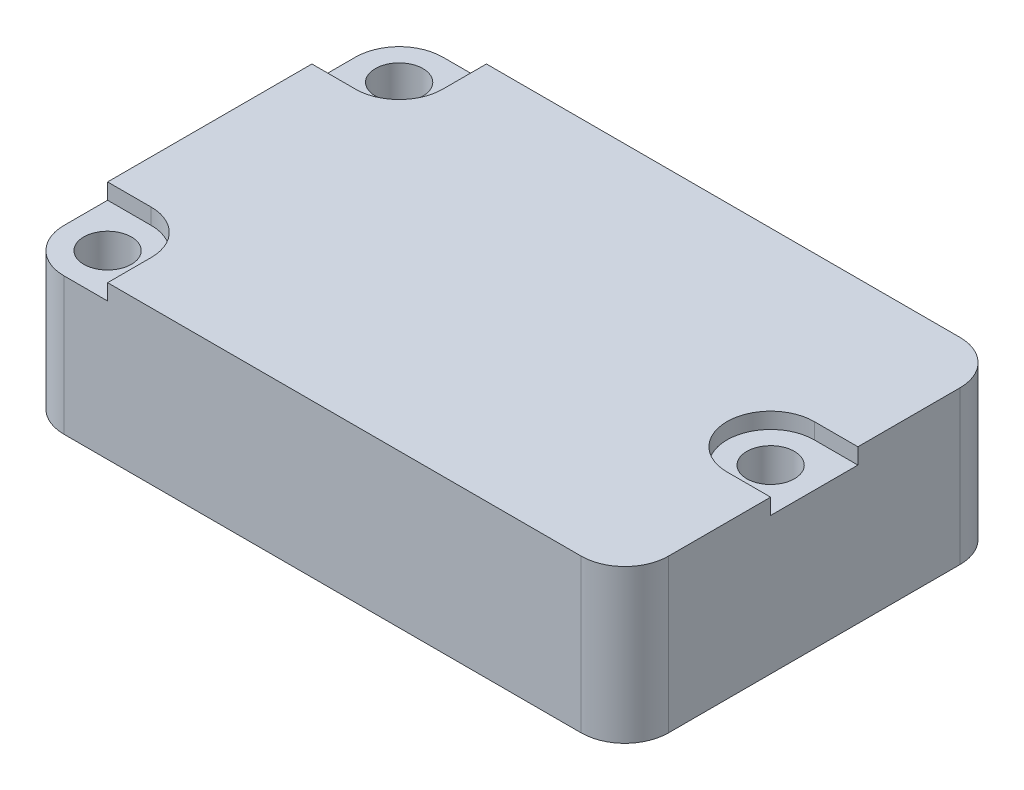
from build123d import *

# Parameters (mm, degrees)
SKETCH1_R           = 1.5
BOSS_EXTRUDE1_DEPTH = 9.65
CUT_EXTRUDE1_START  = -1
SKETCH2_R           = 1.5
CUT_EXTRUDE1_DEPTH  = 1
SKETCH4_W           = 12.876
SKETCH4_H           = 8
CUT_EXTRUDE2_DEPTH  = 3


with BuildPart() as part:
    # Sketch1 → Boss-Extrude1 (new body)
    with BuildSketch(Plane(origin=(0, 0, 0), x_dir=(1, 0, 0), z_dir=(0, 1, 0))):
        with BuildLine():
            Line((2.75, 0), (35.35, 0))
            ThreePointArc((35.35, 0), (37.294543648, -0.805456352), (38.1, -2.75))
            Line((38.1, -2.75), (38.1, -21.126))
            ThreePointArc((38.1, -21.126), (37.294543648, -23.070543648), (35.35, -23.876))
            Line((35.35, -23.876), (2.75, -23.876))
            ThreePointArc((2.75, -23.876), (0.805456352, -23.070543648), (0, -21.126))
            Line((0, -21.126), (0, -2.75))
            ThreePointArc((0, -2.75), (0.805456352, -0.805456352), (2.75, 0))
        make_face()
        with Locations(Location((2.75, -2.75, 0), (0, 0, 270))):
            Circle(SKETCH1_R, mode=Mode.SUBTRACT)
        with Locations(Location((2.75, -21.126, 0), (0, 0, 270))):
            Circle(SKETCH1_R, mode=Mode.SUBTRACT)
        with Locations(Location((35.35, -11.938, 0), (0, 0, 270))):
            Circle(SKETCH1_R, mode=Mode.SUBTRACT)
    extrude(amount=BOSS_EXTRUDE1_DEPTH)

    # Sketch2 → Cut-Extrude1 (cut)
    # profile 1 of 20: a face of its own
    with BuildSketch(Plane(origin=(0, 9.65, 0), x_dir=(1, 0, 0), z_dir=(0, 1, 0)).offset(CUT_EXTRUDE1_START)):
        with BuildLine():
            Line((2.75, -18.376), (0, -18.376))
            Line((0, -18.376), (0, -21.126))
            ThreePointArc((0, -21.126), (0.805456352, -19.181456352), (2.75, -18.376))
        make_face()
    # profile 2 of 20: a face of its own
    with BuildSketch(Plane(origin=(0, 9.65, 0), x_dir=(1, 0, 0), z_dir=(0, 1, 0)).offset(CUT_EXTRUDE1_START)):
        with BuildLine():
            ThreePointArc((2.75, -23.876), (0.805456352, -23.070543648), (0, -21.126))
            Line((0, -21.126), (0, -23.876))
            Line((0, -23.876), (2.75, -23.876))
        make_face()
    # profile 3 of 20: a face of its own
    with BuildSketch(Plane(origin=(0, 9.65, 0), x_dir=(1, 0, 0), z_dir=(0, 1, 0)).offset(CUT_EXTRUDE1_START)):
        with BuildLine():
            ThreePointArc((5.5, -21.126), (4.694543648, -19.181456352), (2.75, -18.376))
            ThreePointArc((2.75, -18.376), (0.805456352, -19.181456352), (0, -21.126))
            ThreePointArc((0, -21.126), (0.805456352, -23.070543648), (2.75, -23.876))
            ThreePointArc((2.75, -23.876), (4.694543648, -23.070543648), (5.5, -21.126))
        make_face()
        with Locations(Location((2.75, -21.126, 0), (0, 0, 270))):
            Circle(SKETCH2_R, mode=Mode.SUBTRACT)
    # profile 4 of 20: a face of its own
    with BuildSketch(Plane(origin=(0, 9.65, 0), x_dir=(1, 0, 0), z_dir=(0, 1, 0)).offset(CUT_EXTRUDE1_START)):
        with Locations(Location((2.75, -21.126, 0), (0, 0, 270))):
            Circle(SKETCH2_R)
    # profile 5 of 20: a face of its own
    with BuildSketch(Plane(origin=(0, 9.65, 0), x_dir=(1, 0, 0), z_dir=(0, 1, 0)).offset(CUT_EXTRUDE1_START)):
        with BuildLine():
            Line((5.5, -23.876), (5.5, -21.126))
            ThreePointArc((5.5, -21.126), (4.694543648, -23.070543648), (2.75, -23.876))
            Line((2.75, -23.876), (5.5, -23.876))
        make_face()
    # profile 6 of 20: a face of its own
    with BuildSketch(Plane(origin=(0, 9.65, 0), x_dir=(1, 0, 0), z_dir=(0, 1, 0)).offset(CUT_EXTRUDE1_START)):
        with BuildLine():
            ThreePointArc((0, -2.75), (0.805456352, -4.694543648), (2.75, -5.5))
            ThreePointArc((2.75, -5.5), (4.694543648, -4.694543648), (5.5, -2.75))
            ThreePointArc((5.5, -2.75), (4.694543648, -0.805456352), (2.75, 0))
            ThreePointArc((2.75, 0), (0.805456352, -0.805456352), (0, -2.75))
        make_face()
        with Locations(Location((2.75, -2.75, 0), (0, 0, 270))):
            Circle(SKETCH2_R, mode=Mode.SUBTRACT)
    # profile 7 of 20: a face of its own
    with BuildSketch(Plane(origin=(0, 9.65, 0), x_dir=(1, 0, 0), z_dir=(0, 1, 0)).offset(CUT_EXTRUDE1_START)):
        with Locations(Location((2.75, -2.75, 0), (0, 0, 270))):
            Circle(SKETCH2_R)
    # profile 8 of 20: a face of its own
    with BuildSketch(Plane(origin=(0, 9.65, 0), x_dir=(1, 0, 0), z_dir=(0, 1, 0)).offset(CUT_EXTRUDE1_START)):
        with BuildLine():
            Line((0, -5.5), (2.75, -5.5))
            ThreePointArc((2.75, -5.5), (0.805456352, -4.694543648), (0, -2.75))
            Line((0, -2.75), (0, -5.5))
        make_face()
    # profile 9 of 20: a face of its own
    with BuildSketch(Plane(origin=(0, 9.65, 0), x_dir=(1, 0, 0), z_dir=(0, 1, 0)).offset(CUT_EXTRUDE1_START)):
        with BuildLine():
            Line((0, 0), (0, -2.75))
            ThreePointArc((0, -2.75), (0.805456352, -0.805456352), (2.75, 0))
            Line((2.75, 0), (0, 0))
        make_face()
    # profile 10 of 20: a face of its own
    with BuildSketch(Plane(origin=(0, 9.65, 0), x_dir=(1, 0, 0), z_dir=(0, 1, 0)).offset(CUT_EXTRUDE1_START)):
        with BuildLine():
            ThreePointArc((2.75, 0), (4.694543648, -0.805456352), (5.5, -2.75))
            Line((5.5, -2.75), (5.5, 0))
            Line((5.5, 0), (2.75, 0))
        make_face()
    # profile 11 of 20: a face of its own
    with BuildSketch(Plane(origin=(0, 9.65, 0), x_dir=(1, 0, 0), z_dir=(0, 1, 0)).offset(CUT_EXTRUDE1_START)):
        with BuildLine():
            ThreePointArc((38.1, -11.938), (37.294543648, -9.993456352), (35.35, -9.188))
            Line((35.35, -9.188), (35.35, -10.438))
            ThreePointArc((35.35, -10.438), (36.410660172, -10.877339828), (36.85, -11.938))
            ThreePointArc((36.85, -11.938), (36.410660172, -12.998660172), (35.35, -13.438))
            Line((35.35, -13.438), (35.35, -14.688))
            ThreePointArc((35.35, -14.688), (37.294543648, -13.882543648), (38.1, -11.938))
        make_face()
    # profile 12 of 20: a face of its own
    with BuildSketch(Plane(origin=(0, 9.65, 0), x_dir=(1, 0, 0), z_dir=(0, 1, 0)).offset(CUT_EXTRUDE1_START)):
        with BuildLine():
            Line((35.35, -10.438), (35.35, -9.188))
            ThreePointArc((35.35, -9.188), (32.6, -11.938), (35.35, -14.688))
            Line((35.35, -14.688), (35.35, -13.438))
            ThreePointArc((35.35, -13.438), (33.85, -11.938), (35.35, -10.438))
        make_face()
    # profile 13 of 20: a face of its own
    with BuildSketch(Plane(origin=(0, 9.65, 0), x_dir=(1, 0, 0), z_dir=(0, 1, 0)).offset(CUT_EXTRUDE1_START)):
        with BuildLine():
            ThreePointArc((36.85, -11.938), (36.410660172, -10.877339828), (35.35, -10.438))
            Line((35.35, -10.438), (35.35, -13.438))
            ThreePointArc((35.35, -13.438), (36.410660172, -12.998660172), (36.85, -11.938))
        make_face()
    # profile 14 of 20: a face of its own
    with BuildSketch(Plane(origin=(0, 9.65, 0), x_dir=(1, 0, 0), z_dir=(0, 1, 0)).offset(CUT_EXTRUDE1_START)):
        with BuildLine():
            Line((35.35, -13.438), (35.35, -10.438))
            ThreePointArc((35.35, -10.438), (33.85, -11.938), (35.35, -13.438))
        make_face()
    # profile 15 of 20: a face of its own
    with BuildSketch(Plane(origin=(0, 9.65, 0), x_dir=(1, 0, 0), z_dir=(0, 1, 0)).offset(CUT_EXTRUDE1_START)):
        with BuildLine():
            ThreePointArc((36.85, -11.938), (36.410660172, -10.877339828), (35.35, -10.438))
            Line((35.35, -10.438), (35.35, -13.438))
            ThreePointArc((35.35, -13.438), (36.410660172, -12.998660172), (36.85, -11.938))
        make_face()
    # profile 16 of 20: a face of its own
    with BuildSketch(Plane(origin=(0, 9.65, 0), x_dir=(1, 0, 0), z_dir=(0, 1, 0)).offset(CUT_EXTRUDE1_START)):
        with BuildLine():
            Line((35.35, -13.438), (35.35, -10.438))
            ThreePointArc((35.35, -10.438), (33.85, -11.938), (35.35, -13.438))
        make_face()
    # profile 17 of 20: a face of its own
    with BuildSketch(Plane(origin=(0, 9.65, 0), x_dir=(1, 0, 0), z_dir=(0, 1, 0)).offset(CUT_EXTRUDE1_START)):
        with BuildLine():
            ThreePointArc((38.1, -11.938), (37.294543648, -9.993456352), (35.35, -9.188))
            Line((35.35, -9.188), (35.35, -10.438))
            ThreePointArc((35.35, -10.438), (36.410660172, -10.877339828), (36.85, -11.938))
            ThreePointArc((36.85, -11.938), (36.410660172, -12.998660172), (35.35, -13.438))
            Line((35.35, -13.438), (35.35, -14.688))
            ThreePointArc((35.35, -14.688), (37.294543648, -13.882543648), (38.1, -11.938))
        make_face()
    # profile 18 of 20: a face of its own
    with BuildSketch(Plane(origin=(0, 9.65, 0), x_dir=(1, 0, 0), z_dir=(0, 1, 0)).offset(CUT_EXTRUDE1_START)):
        with BuildLine():
            Line((35.35, -10.438), (35.35, -9.188))
            ThreePointArc((35.35, -9.188), (32.6, -11.938), (35.35, -14.688))
            Line((35.35, -14.688), (35.35, -13.438))
            ThreePointArc((35.35, -13.438), (33.85, -11.938), (35.35, -10.438))
        make_face()
    # profile 19 of 20: a face of its own
    with BuildSketch(Plane(origin=(0, 9.65, 0), x_dir=(1, 0, 0), z_dir=(0, 1, 0)).offset(CUT_EXTRUDE1_START)):
        with BuildLine():
            Line((38.1, -14.688), (38.1, -11.938))
            ThreePointArc((38.1, -11.938), (37.294543648, -13.882543648), (35.35, -14.688))
            Line((35.35, -14.688), (38.1, -14.688))
        make_face()
    # profile 20 of 20: a face of its own
    with BuildSketch(Plane(origin=(0, 9.65, 0), x_dir=(1, 0, 0), z_dir=(0, 1, 0)).offset(CUT_EXTRUDE1_START)):
        with BuildLine():
            Line((38.1, -9.188), (35.35, -9.188))
            ThreePointArc((35.35, -9.188), (37.294543648, -9.993456352), (38.1, -11.938))
            Line((38.1, -11.938), (38.1, -9.188))
        make_face()
    extrude(amount=CUT_EXTRUDE1_DEPTH, mode=Mode.SUBTRACT)

    # Sketch4 → Cut-Extrude2 (cut)
    with BuildSketch(Plane.ZY):
        with Locations((11.938, 4)):
            Rectangle(SKETCH4_W, SKETCH4_H)
    extrude(amount=-CUT_EXTRUDE2_DEPTH, mode=Mode.SUBTRACT)


solid = part.part
